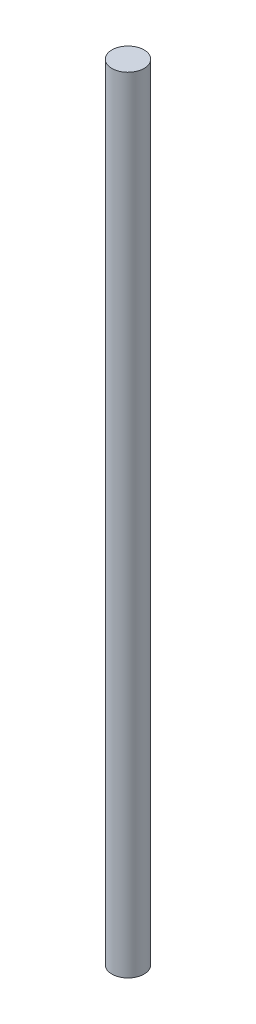
from build123d import *

# Parameters (mm, degrees)
SKETCH2_R           = 4
BOSS_EXTRUDE1_DEPTH = 195


with BuildPart() as part:
    # Sketch2 → Boss-Extrude1 (new body)
    with BuildSketch(Plane(origin=(0, 0, 0), x_dir=(1, 0, 0), z_dir=(0, 1, 0))):
        with Locations(Location((0, 0, 0), (0, 0, 270))):
            Circle(SKETCH2_R)
    extrude(amount=BOSS_EXTRUDE1_DEPTH)


solid = part.part
